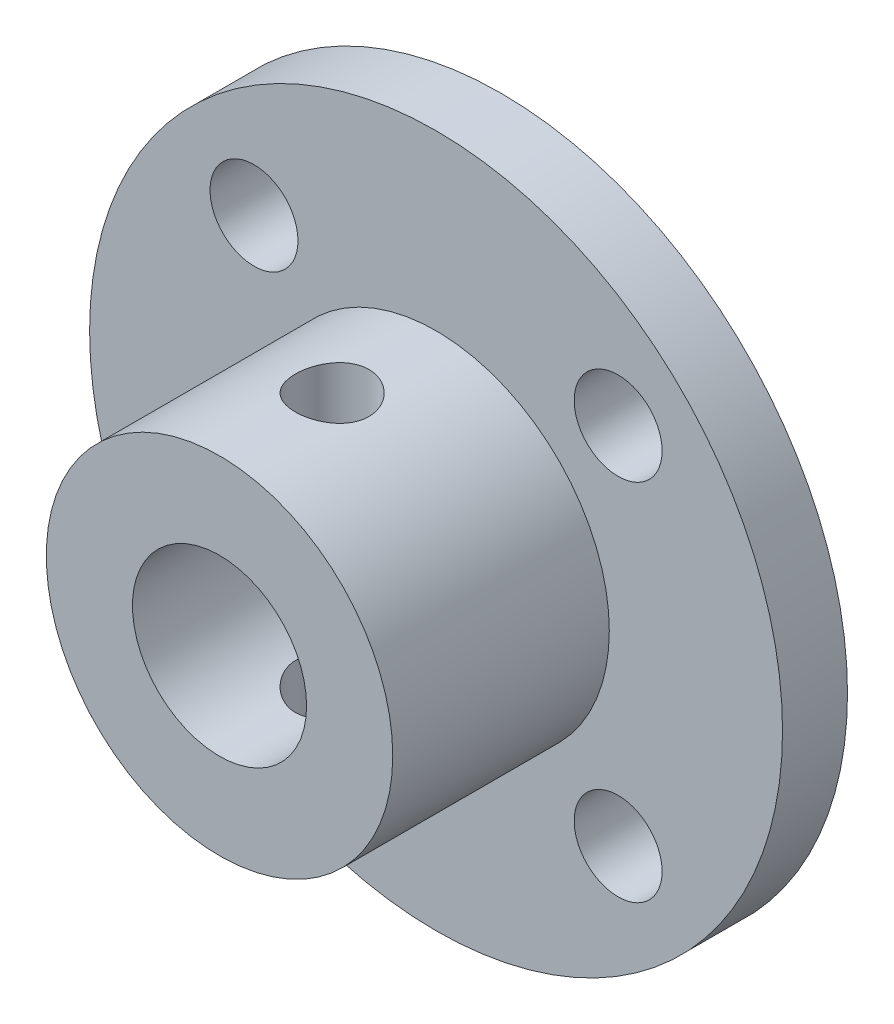
from build123d import *

# Parameters (mm, degrees)
ESQUISSE1_R                  = 16
ESQUISSE1_R_2                = 2.03
BOSS_EXTRU_1_DEPTH           = 3
ESQUISSE2_R                  = 8
ESQUISSE2_R_2                = 4.02
BOSS_EXTRU_2_DEPTH           = 10
ESQUISSE3_R                  = 4.02
ENL_V_MAT_EXTRU_1_DEPTH      = 27.095976701
ENL_V_MAT_EXTRU_2_DEPTH      = 27.095976701
ENL_V_MAT_EXTRU_2_DEPTH_BACK = 27.095976701
ESQUISSE4_R                  = 1.7


with BuildPart() as part:
    # Esquisse1 → Boss.-Extru.1 (new body)
    with BuildSketch(Plane.XY):
        Circle(ESQUISSE1_R)
        with Locations((-8.407499628, 8.407499628)):
            Circle(ESQUISSE1_R_2, mode=Mode.SUBTRACT)
        with Locations((8.407499628, 8.407499628)):
            Circle(ESQUISSE1_R_2, mode=Mode.SUBTRACT)
        with Locations((8.407499628, -8.407499628)):
            Circle(ESQUISSE1_R_2, mode=Mode.SUBTRACT)
        with Locations((-8.407499628, -8.407499628)):
            Circle(ESQUISSE1_R_2, mode=Mode.SUBTRACT)
    extrude(amount=BOSS_EXTRU_1_DEPTH)

    # Esquisse2 → Boss.-Extru.2 (add)
    with BuildSketch(Plane.XY.offset(3)):
        Circle(ESQUISSE2_R)
        Circle(ESQUISSE2_R_2, mode=Mode.SUBTRACT)
    extrude(amount=BOSS_EXTRU_2_DEPTH)

    # Esquisse3 → Enlèv. mat.-Extru.1 (cut, through all)
    with BuildSketch(Plane.XY.offset(13)):
        Circle(ESQUISSE3_R)
    extrude(amount=-ENL_V_MAT_EXTRU_1_DEPTH, mode=Mode.SUBTRACT)

    # Esquisse4 → Enlèv. mat.-Extru.2 (cut, two sides: drawn at the far end of the back side and taken through both)
    with BuildSketch(Plane(origin=(0, 0, 0), x_dir=(1, 0, 0), z_dir=(0, 1, 0)).offset(-ENL_V_MAT_EXTRU_2_DEPTH_BACK)):
        with Locations(Location((0, -7.8, 0), (0, 0, 270))):
            Circle(ESQUISSE4_R)
    extrude(amount=ENL_V_MAT_EXTRU_2_DEPTH + ENL_V_MAT_EXTRU_2_DEPTH_BACK, mode=Mode.SUBTRACT)


solid = part.part
